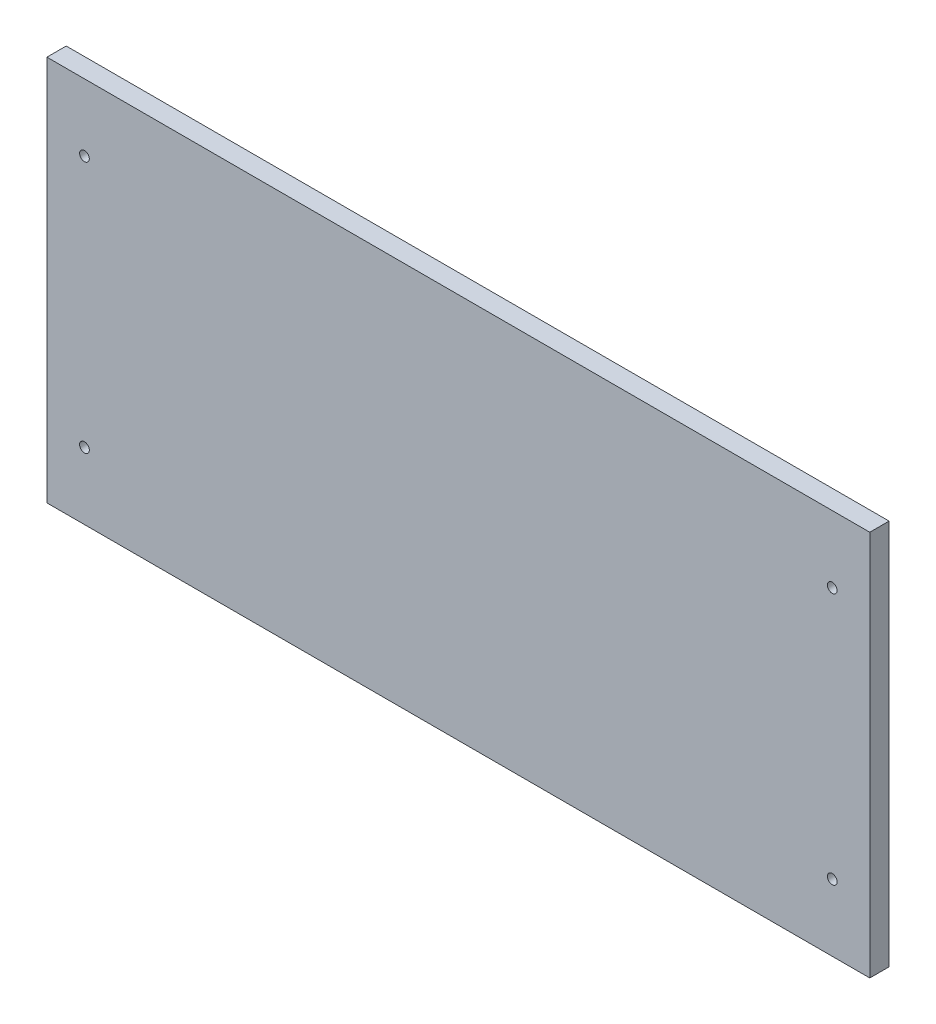
from build123d import *

# Parameters (mm, degrees)
SKETCH1_W  = 270.7
SKETCH1_H  = 127
SKETCH1_R  = 1.6
WALL_DEPTH = 6.35


with BuildPart() as part:
    # Sketch1 → Wall (new body)
    with BuildSketch(Plane.XY):
        with Locations((135.35, 63.5)):
            Rectangle(SKETCH1_W, SKETCH1_H)
        with Locations((12.35, 105)):
            Circle(SKETCH1_R, mode=Mode.SUBTRACT)
        with Locations(Location((258.35, 105, 0), (0, 0, 180))):
            Circle(SKETCH1_R, mode=Mode.SUBTRACT)
        with Locations((258.35, 22)):
            Circle(SKETCH1_R, mode=Mode.SUBTRACT)
        with Locations(Location((12.35, 22, 0), (0, 0, 180))):
            Circle(SKETCH1_R, mode=Mode.SUBTRACT)
    extrude(amount=WALL_DEPTH)


solid = part.part
